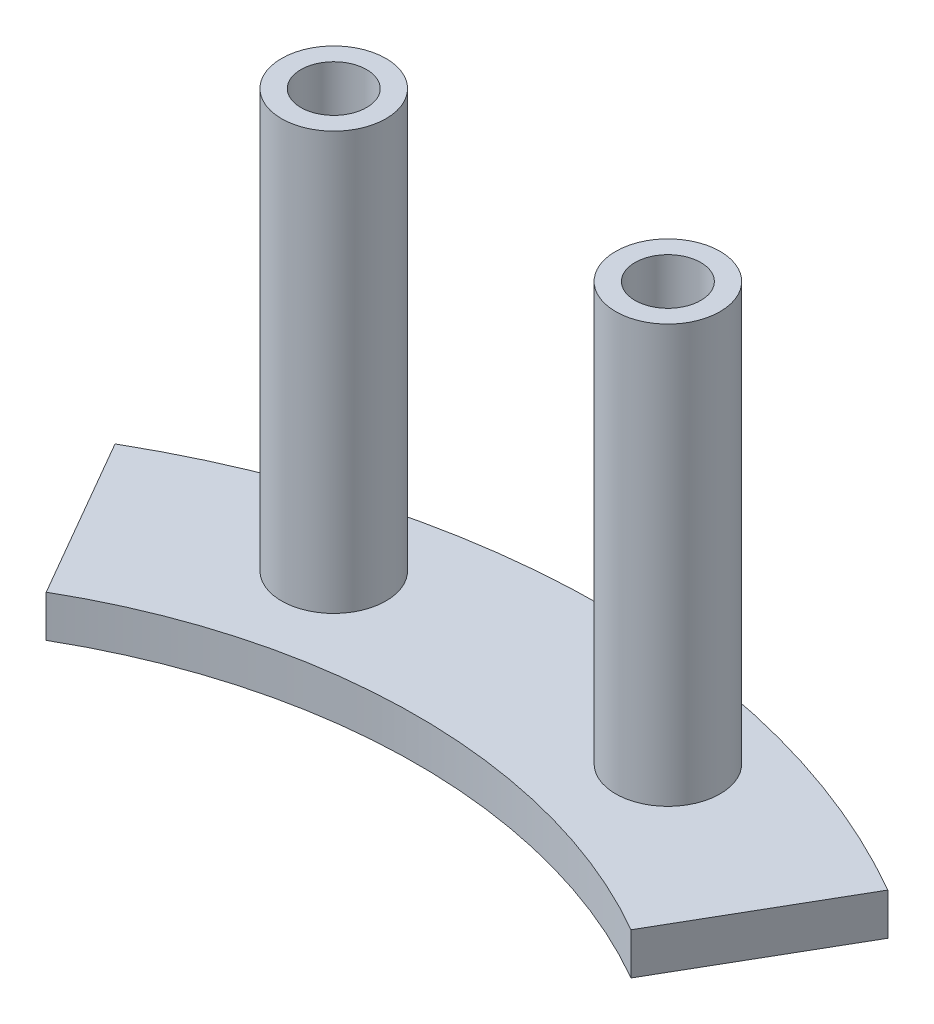
from build123d import *

# Parameters (mm, degrees)
BOSS_EXTRUDE1_DEPTH = 2
SKETCH2_R           = 2.5
BOSS_EXTRUDE2_DEPTH = 20
SKETCH5_R           = 1.575
CUT_EXTRUDE1_DEPTH  = 3.5


with BuildPart() as part:
    # Sketch1 → Boss-Extrude1 (new body)
    with BuildSketch(Plane(origin=(0, 0, 0), x_dir=(1, 0, 0), z_dir=(0, 1, 0))):
        with BuildLine():
            Line((-18.5, 32.04293994), (-14, 24.248711306))
            ThreePointArc((-14, 24.248711306), (0, 28), (14, 24.248711306))
            Line((14, 24.248711306), (18.5, 32.04293994))
            ThreePointArc((18.5, 32.04293994), (0, 37), (-18.5, 32.04293994))
        make_face()
    extrude(amount=BOSS_EXTRUDE1_DEPTH)

    # Sketch2 → Boss-Extrude2 (add)
    with BuildSketch(Plane(origin=(0, 2, 0), x_dir=(1, 0, 0), z_dir=(0, 1, 0))):
        with Locations(Location((-8, 32.015621187, 0), (0, 0, 90))):
            Circle(SKETCH2_R)
        with Locations(Location((8, 32.015621187, 0), (0, 0, 90))):
            Circle(SKETCH2_R)
    extrude(amount=BOSS_EXTRUDE2_DEPTH)

    # Sketch5 → Cut-Extrude1 (cut)
    with BuildSketch(Plane(origin=(0, 22, 0), x_dir=(1, 0, 0), z_dir=(0, 1, 0))):
        with Locations(Location((-8, 32.015621187, 0), (0, 0, 270))):
            Circle(SKETCH5_R)
        with Locations(Location((8, 32.015621187, 0), (0, 0, 270))):
            Circle(SKETCH5_R)
    extrude(amount=-CUT_EXTRUDE1_DEPTH, mode=Mode.SUBTRACT)


solid = part.part
